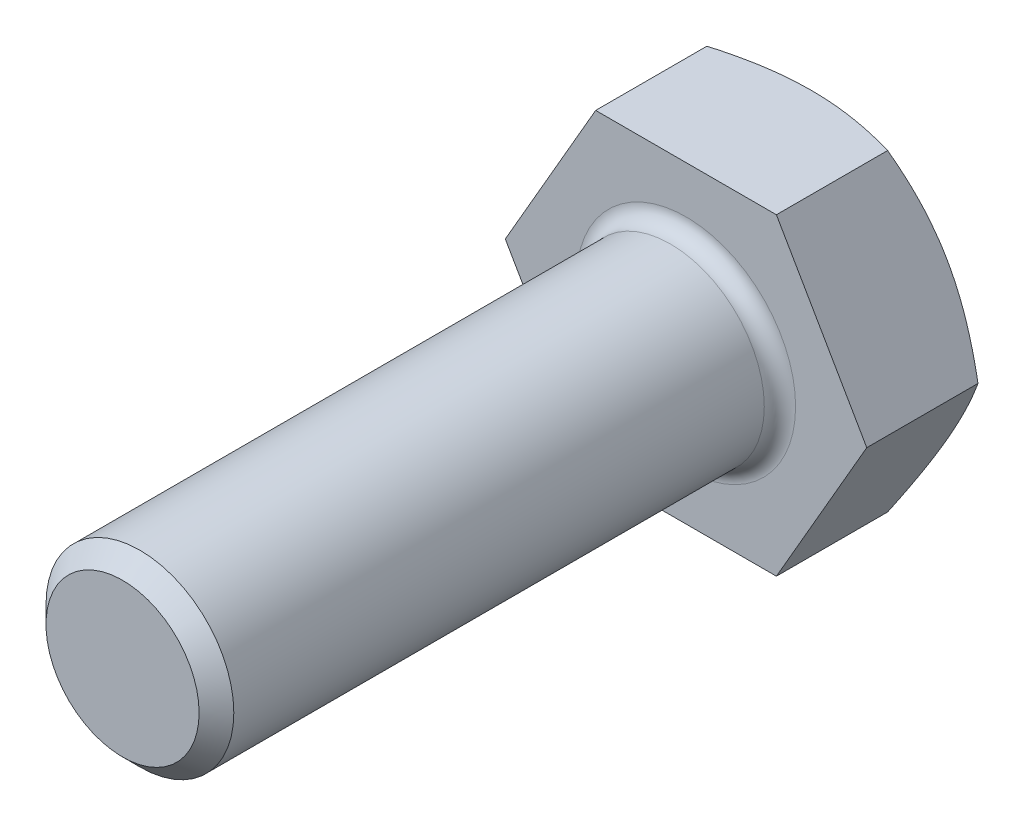
from build123d import *

# Parameters (mm, degrees)
EXTRUDE_1_DEPTH = 4
SKETCH_2_R      = 3
EXTRUDE_2_DEPTH = 18
CHAMFER_1_SIZE  = 0.5545
FILLET_1_R      = 0.5


with BuildPart() as part:
    # Эскиз1 → Бобышка-Вытянуть1 (new body)
    with BuildSketch(Plane.XY):
        Polygon((-2.886751346, 5), (-5.773502692, 0), (-2.886751346, -5), (2.886751346, -5), (5.773502692, 0), (2.886751346, 5), align=None)
    extrude(amount=EXTRUDE_1_DEPTH)

    # Эскиз2 → Бобышка-Вытянуть2 (add)
    with BuildSketch(Plane.XY.offset(4)):
        Circle(SKETCH_2_R)
    extrude(amount=EXTRUDE_2_DEPTH)

    # Эскиз3 → Вырез-Повернуть1 (revolve, cut)
    with BuildSketch(Plane(origin=(0, 0, 0), x_dir=(0, 0, -1), z_dir=(1, 0, 0))):
        Polygon((0, 5), (0, 6.24), (-0.715914334, 6.24), align=None)
    revolve(axis=Axis((0, 0, 1000), (0, 0, -1)), mode=Mode.SUBTRACT)

    # Фаска1
    chamfer_1_edges = [part.edges().sort_by_distance(p)[0] for p in [
        (-3, 0, 22),
    ]]
    chamfer(chamfer_1_edges, length=CHAMFER_1_SIZE)

    # Скругление1
    fillet_1_edges = [part.edges().sort_by_distance(p)[0] for p in [
        (-3, 0, 4),
    ]]
    fillet(fillet_1_edges, radius=FILLET_1_R)


solid = part.part
